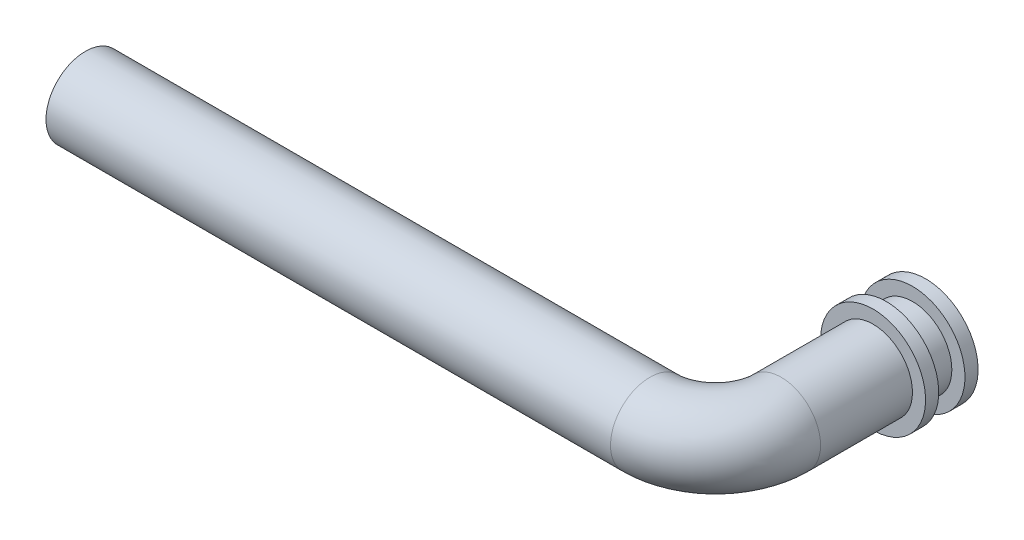
from build123d import *

# Parameters (mm, degrees)
SKETCH2_R           = 6
SKETCH4_R           = 8
BOSS_EXTRUDE1_DEPTH = 2
SKETCH5_R           = 8
SKETCH5_R_2         = 6
BOSS_EXTRUDE2_DEPTH = 2


with BuildPart() as part:
    # Sweep1: sweep along a curve in space
    with BuildLine() as sweep1_path:
        Line((0, 0, 0), (0, 0, 20))
        ThreePointArc((-10, 0, 30), (-2.928932188, 0, 27.071067812), (0, 0, 20))
        Line((-10, 0, 30), (-96, 0, 30))
    # Sketch2 → Sweep1 (sweep)
    with BuildSketch(Plane.XY):
        Circle(SKETCH2_R)
    sweep(path=sweep1_path.line)

    # Sketch4 → Boss-Extrude1 (add)
    with BuildSketch(Plane(origin=(0, 0, 0), x_dir=(-1, 0, 0), z_dir=(0, 0, -1))):
        Circle(SKETCH4_R)
    extrude(amount=BOSS_EXTRUDE1_DEPTH)

    # Sketch5 → Boss-Extrude2 (add)
    with BuildSketch(Plane(origin=(0, 0, 6), x_dir=(-1, 0, 0), z_dir=(0, 0, -1))):
        Circle(SKETCH5_R)
        with Locations(Location((0, 0, 0), (0, 0, 180))):
            Circle(SKETCH5_R_2, mode=Mode.SUBTRACT)
    extrude(amount=BOSS_EXTRUDE2_DEPTH)


solid = part.part
